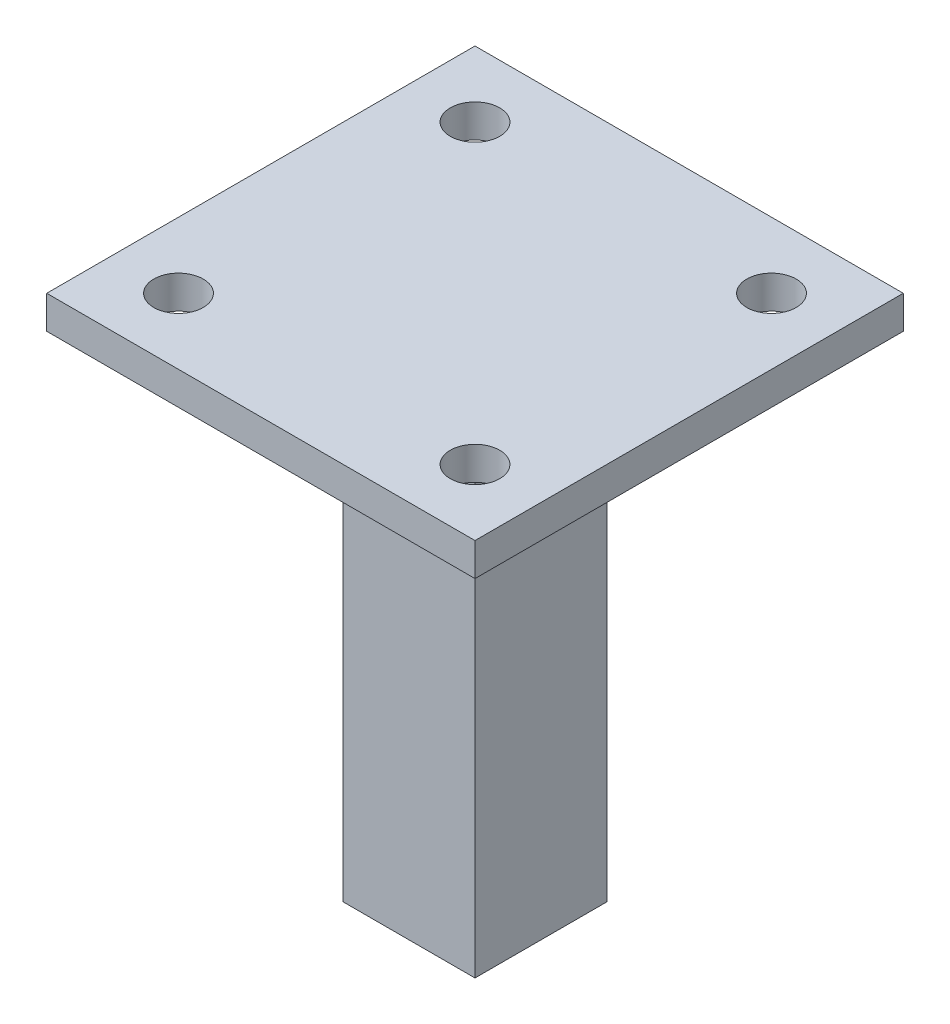
from build123d import *

# Parameters (mm, degrees)
SKETCH1_W           = 40
SKETCH1_H           = 40
BOSS_EXTRUDE1_DEPTH = 150
SKETCH2_W           = 130
SKETCH2_H           = 130
SKETCH2_R           = 7.5
BOSS_EXTRUDE2_DEPTH = 10


with BuildPart() as part:
    # Sketch1 → Boss-Extrude1 (new body)
    with BuildSketch(Plane(origin=(0, 0, 0), x_dir=(1, 0, 0), z_dir=(0, 1, 0))):
        Rectangle(SKETCH1_W, SKETCH1_H)
    extrude(amount=BOSS_EXTRUDE1_DEPTH)

    # Sketch2 → Boss-Extrude2 (add)
    with BuildSketch(Plane(origin=(0, 150, 0), x_dir=(1, 0, 0), z_dir=(0, 1, 0))):
        Rectangle(SKETCH2_W, SKETCH2_H)
        with Locations(Location((-45, -45, 0), (0, 0, 270))):
            Circle(SKETCH2_R, mode=Mode.SUBTRACT)
        with Locations(Location((45, -45, 0), (0, 0, 270))):
            Circle(SKETCH2_R, mode=Mode.SUBTRACT)
        with Locations(Location((45, 45, 0), (0, 0, 270))):
            Circle(SKETCH2_R, mode=Mode.SUBTRACT)
        with Locations(Location((-45, 45, 0), (0, 0, 270))):
            Circle(SKETCH2_R, mode=Mode.SUBTRACT)
    extrude(amount=BOSS_EXTRUDE2_DEPTH)


solid = part.part
